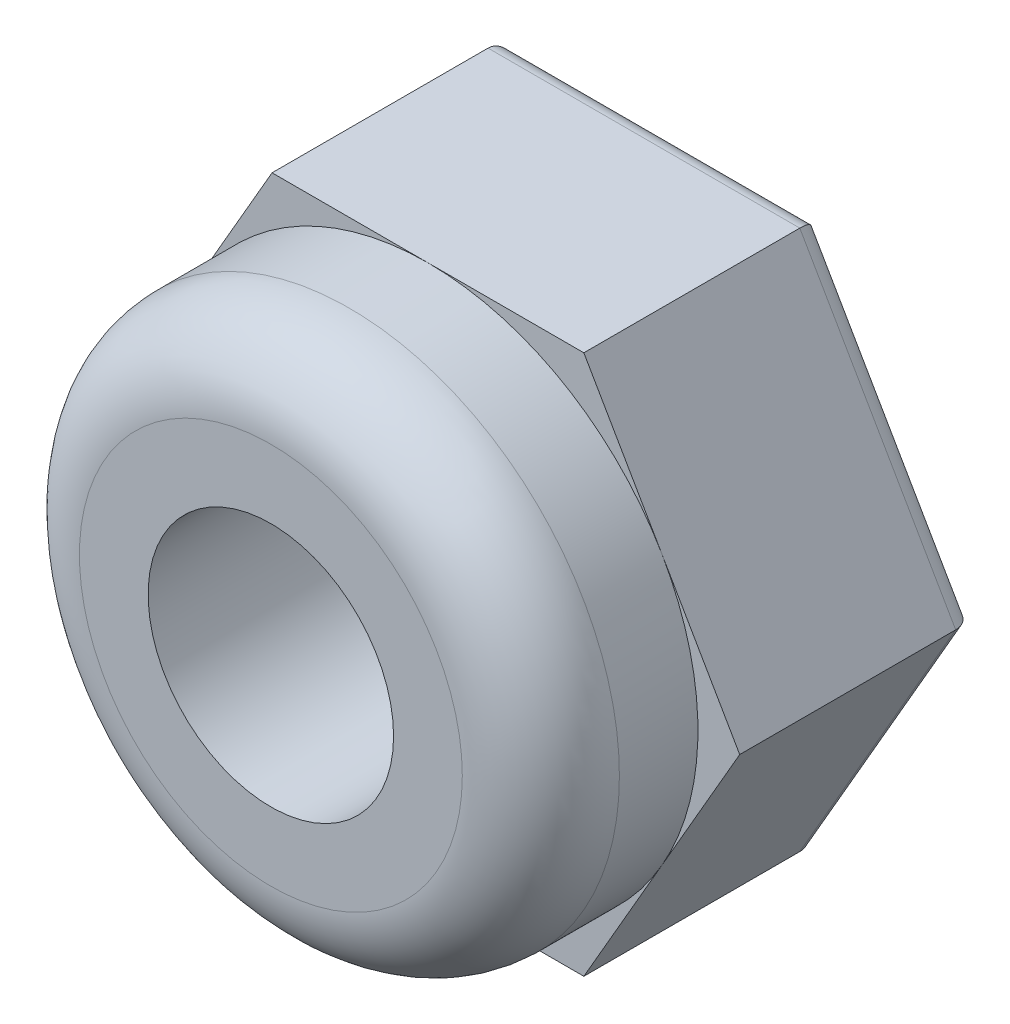
from build123d import *

# Parameters (mm, degrees)
SKETCH1_R           = 1.25
BOSS_EXTRUDE1_DEPTH = 2.4
SKETCH2_R           = 2.75
SKETCH2_R_2         = 1.25
BOSS_EXTRUDE2_DEPTH = 1.6
FILLET1_R           = 0.2
FILLET2_R           = 0.8


with BuildPart() as part:
    # Sketch1 → Boss-Extrude1 (new body)
    with BuildSketch(Plane.XY):
        Polygon((3.175426481, 0), (1.58771324, 2.75), (-1.58771324, 2.75), (-3.175426481, 0), (-1.58771324, -2.75), (1.58771324, -2.75), align=None)
        Circle(SKETCH1_R, mode=Mode.SUBTRACT)
    extrude(amount=BOSS_EXTRUDE1_DEPTH)

    # Sketch2 → Boss-Extrude2 (add)
    with BuildSketch(Plane.XY.offset(2.4)):
        with Locations(Location((0, 0, 0), (0, 0, 150))):
            Circle(SKETCH2_R)
        Circle(SKETCH2_R_2, mode=Mode.SUBTRACT)
    extrude(amount=BOSS_EXTRUDE2_DEPTH)

    # Fillet1
    fillet1_edges = [part.edges().sort_by_distance(p)[0] for p in [
        (-1.25, 0, 0),
        (0, -2.75, 0),
        (-2.38156986, -1.375, 0),
        (-2.38156986, 1.375, 0),
        (0, 2.75, 0),
        (2.38156986, 1.375, 0),
        (2.38156986, -1.375, 0),
    ]]
    fillet(fillet1_edges, radius=FILLET1_R)

    # Fillet2
    fillet2_edges = [part.edges().sort_by_distance(p)[0] for p in [
        (2.38156986, -1.375, 4),
    ]]
    fillet(fillet2_edges, radius=FILLET2_R)


solid = part.part
